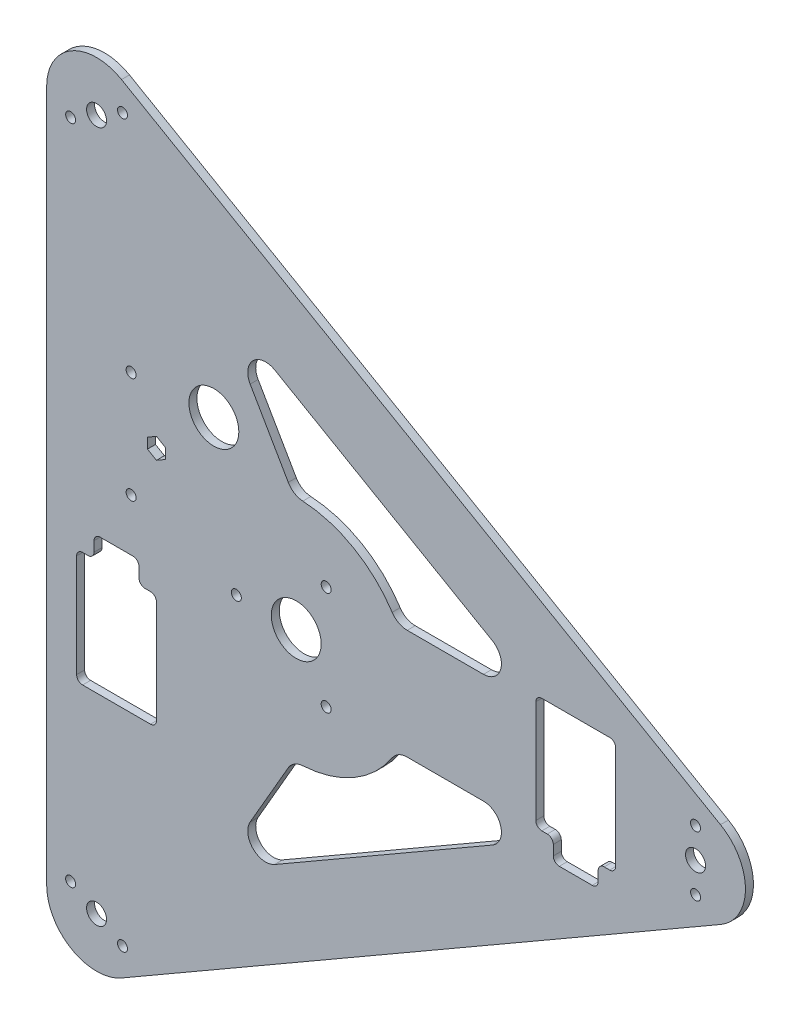
from build123d import *

# Parameters (mm, degrees)
BOARD_DEPTH    = 0.8
CUT_DEPTH      = 60.975412975
HOLESSKE_R     = 0.5
HOLESSKE_R_2   = 2.5
HOLES_DEPTH    = 60.975412975
HOLES2SKE_R    = 1
HOLES2_DEPTH   = 60.975412975
HOLES3SKE_R    = 0.5
HOLES3_DEPTH   = 60.975412975
HOLES4SKE_R    = 2.5
HOLES4SKE_R_2  = 0.5
HOLES4_DEPTH   = 60.975412975
FILLET1_R      = 1.8
SERVOSET_DEPTH = 10
FILLET2_R      = 0.6


with BuildPart() as part:
    # BoardSke → Board (new body)
    with BuildSketch(Plane.XY):
        with BuildLine():
            Line((42.5, 4.330127019), (-17.5, 38.97114317))
            ThreePointArc((-17.5, 38.97114317), (-22.5, 38.97114317), (-25, 34.641016151))
            Line((-25, 34.641016151), (-25, -34.641016151))
            ThreePointArc((-25, -34.641016151), (-22.5, -38.97114317), (-17.5, -38.97114317))
            Line((-17.5, -38.97114317), (42.5, -4.330127019))
            ThreePointArc((42.5, -4.330127019), (45, 0), (42.5, 4.330127019))
        make_face()
    extrude(amount=BOARD_DEPTH)

    # CutSke → Cut (cut, through all)
    with BuildSketch(Plane.XY.offset(0.8)):
        with BuildLine():
            Line((-7.973720558, 24.810889132), (-0.286612748, 11.496427842))
            ThreePointArc((-0.286612748, 11.496427842), (5.75, 9.959292144), (10.099504938, 5.5))
            Line((10.099504938, 5.5), (25.473720558, 5.5))
            Line((25.473720558, 5.5), (-7.973720558, 24.810889132))
        make_face()
        with BuildLine():
            Line((25.473720558, -5.5), (10.099504938, -5.5))
            ThreePointArc((10.099504938, -5.5), (5.75, -9.959292144), (-0.286612748, -11.496427842))
            Line((-0.286612748, -11.496427842), (-7.973720558, -24.810889132))
            Line((-7.973720558, -24.810889132), (25.473720558, -5.5))
        make_face()
    extrude(amount=-CUT_DEPTH, mode=Mode.SUBTRACT)

    # HolesSke → Holes (cut, through all)
    with BuildSketch(Plane.XY.offset(0.8)):
        with Locations((-6, 0)):
            Circle(HOLESSKE_R)
        with Locations((3, 5.196152423)):
            Circle(HOLESSKE_R)
        with Locations((3, -5.196152423)):
            Circle(HOLESSKE_R)
        Circle(HOLESSKE_R_2)
    extrude(amount=-HOLES_DEPTH, mode=Mode.SUBTRACT)

    # Holes2Ske → Holes2 (cut, through all)
    with BuildSketch(Plane.XY.offset(0.8)):
        with Locations((40, 0)):
            Circle(HOLES2SKE_R)
        with Locations((-20, -34.641016151)):
            Circle(HOLES2SKE_R)
        with Locations((-20, 34.641016151)):
            Circle(HOLES2SKE_R)
    extrude(amount=-HOLES2_DEPTH, mode=Mode.SUBTRACT)

    # Holes3Ske → Holes3 (cut, through all)
    with BuildSketch(Plane.XY.offset(0.8)):
        with Locations((40, 3)):
            Circle(HOLES3SKE_R)
        with Locations((40, -3)):
            Circle(HOLES3SKE_R)
        with Locations((-22.598076211, -33.141016151)):
            Circle(HOLES3SKE_R)
        with Locations((-17.401923789, -36.141016151)):
            Circle(HOLES3SKE_R)
        with Locations((-17.401923789, 36.141016151)):
            Circle(HOLES3SKE_R)
        with Locations((-22.598076211, 33.141016151)):
            Circle(HOLES3SKE_R)
    extrude(amount=-HOLES3_DEPTH, mode=Mode.SUBTRACT)

    # Holes4Ske → Holes4 (cut, through all)
    with BuildSketch(Plane.XY.offset(0.8)):
        with Locations((-8.25, 14.289419162)):
            Circle(HOLES4SKE_R)
        with Locations((-16.538942365, 14.044736682)):
            Circle(HOLES4SKE_R_2)
        with Locations((-16.538942365, 3.413610092)):
            Circle(HOLES4SKE_R_2)
        Polygon((-13.101840307, 8.209558145), (-13.101840307, 9.248788629), (-14.001840307, 9.768403872), (-14.901840307, 9.248788629), (-14.901840307, 8.209558145), (-14.001840307, 7.689942902), align=None)
    extrude(amount=-HOLES4_DEPTH, mode=Mode.SUBTRACT)

    # Fillet1
    fillet1_edges = [part.edges().sort_by_distance(p)[0] for p in [
        (25.473720558, 5.5, 0.4),
        (10.099504938, 5.5, 0.4),
        (-0.286612748, 11.496427842, 0.4),
        (-7.973720558, 24.810889132, 0.4),
        (25.473720558, -5.5, 0.4),
        (-7.973720558, -24.810889132, 0.4),
        (-0.286612748, -11.496427842, 0.4),
        (10.099504938, -5.5, 0.4),
    ]]
    fillet(fillet1_edges, radius=FILLET1_R)

    # ServoSetSke → ServoSet (cut)
    with BuildSketch(Plane.XY.offset(0.8)):
        Polygon((30.25, -5.155181486), (32, -5.155181486), (32, 6.344818514), (24, 6.344818514), (24, -5.155181486), (25.75, -5.155181486), (25.75, -7.355181486), (30.25, -7.355181486), align=None)
        Polygon((-15.75, -4), (-14, -4), (-14, -15.5), (-22, -15.5), (-22, -4), (-20.25, -4), (-20.25, -1.8), (-15.75, -1.8), align=None)
    extrude(amount=-SERVOSET_DEPTH, mode=Mode.SUBTRACT)

    # Fillet2
    fillet2_edges = [part.edges().sort_by_distance(p)[0] for p in [
        (32, 6.344818514, 0.4),
        (32, -5.155181486, 0.4),
        (30.25, -5.155181486, 0.4),
        (30.25, -7.355181486, 0.4),
        (25.75, -7.355181486, 0.4),
        (25.75, -5.155181486, 0.4),
        (24, -5.155181486, 0.4),
        (24, 6.344818514, 0.4),
        (-14, -4, 0.4),
        (-14, -15.5, 0.4),
        (-22, -15.5, 0.4),
        (-22, -4, 0.4),
        (-20.25, -4, 0.4),
        (-20.25, -1.8, 0.4),
        (-15.75, -1.8, 0.4),
        (-15.75, -4, 0.4),
    ]]
    fillet(fillet2_edges, radius=FILLET2_R)


solid = part.part
